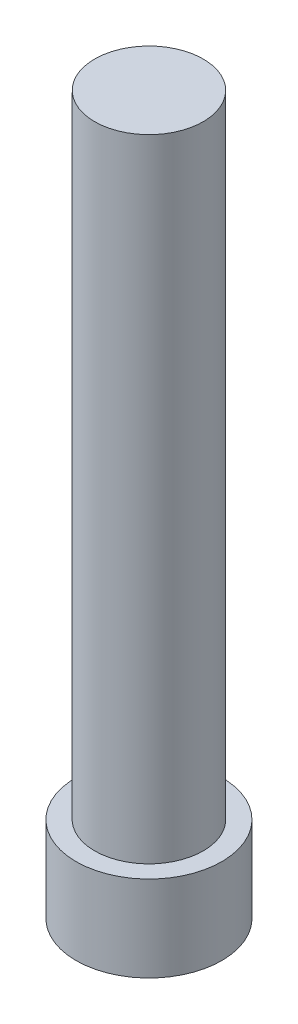
from build123d import *

# Parameters (mm, degrees)
SKETCH2_R           = 2.55
BOSS_EXTRUDE1_DEPTH = 3
SKETCH3_R           = 1.9
BOSS_EXTRUDE2_DEPTH = 22.1


with BuildPart() as part:
    # Sketch2 → Boss-Extrude1 (new body)
    with BuildSketch(Plane(origin=(0, 0, 0), x_dir=(1, 0, 0), z_dir=(0, 1, 0))):
        with Locations(Location((0, 0, 0), (0, 0, 270))):
            Circle(SKETCH2_R)
    extrude(amount=BOSS_EXTRUDE1_DEPTH)

    # Sketch3 → Boss-Extrude2 (add)
    with BuildSketch(Plane(origin=(0, 3, 0), x_dir=(1, 0, 0), z_dir=(0, 1, 0))):
        with Locations(Location((0, 0, 0), (0, 0, 270))):
            Circle(SKETCH3_R)
    extrude(amount=BOSS_EXTRUDE2_DEPTH)


solid = part.part
